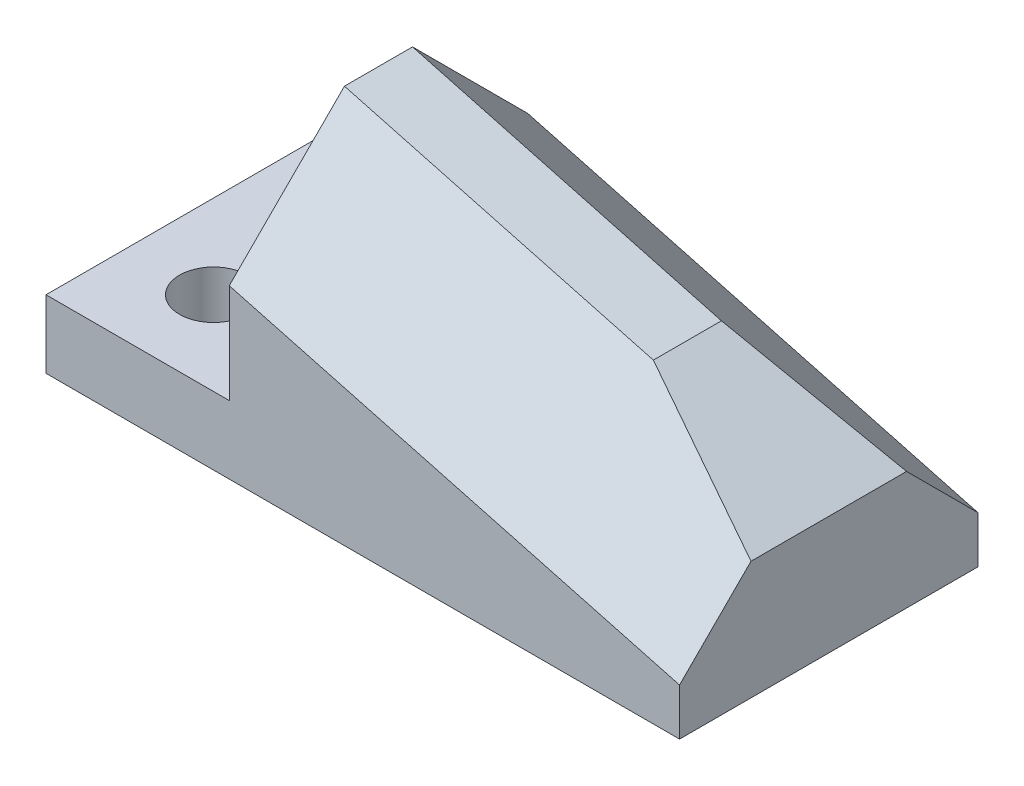
from build123d import *

# Parameters (mm, degrees)
SKETCH1_W           = 121
SKETCH1_H           = 13
BOSS_EXTRUDE1_DEPTH = 28.5
SKETCH2_R           = 6.5
CUT_EXTRUDE1_DEPTH  = 69.128554953
BOSS_EXTRUDE2_DEPTH = 57
CUT_EXTRUDE3_REACH  = 93.09
CUT_EXTRUDE4_REACH  = 93.09


with BuildPart() as part:
    # Sketch1 → Boss-Extrude1 (new, symmetric)
    with BuildSketch(Plane.XY):
        with Locations((0, 6.5)):
            Rectangle(SKETCH1_W, SKETCH1_H)
    extrude(amount=BOSS_EXTRUDE1_DEPTH, both=True)

    # Sketch2 → Cut-Extrude1 (cut, through all)
    with BuildSketch(Plane(origin=(0, 13, 0), x_dir=(1, 0, 0), z_dir=(0, 1, 0))):
        with Locations(Location((-44.5, 12.5, 0), (0, 0, 270))):
            Circle(SKETCH2_R)
        with Locations(Location((-44.5, -12.5, 0), (0, 0, 270))):
            Circle(SKETCH2_R)
    extrude(amount=-CUT_EXTRUDE1_DEPTH, mode=Mode.SUBTRACT)

    # Sketch3 → Boss-Extrude2 (add)
    with BuildSketch(Plane.XY.offset(28.5)):
        Polygon((-25.5, 13), (-25.5, 54), (33.5, 38.190997647), (60.5, 22.602540378), (60.5, 13), align=None)
    extrude(amount=-BOSS_EXTRUDE2_DEPTH)

    # Sketch7 → Cut-Extrude3 (cut, up to next)
    with BuildSketch(Plane(origin=(6.940887603, 25.903745183, 25.903745183), x_dir=(0.9825200508486979, -0.13163272708614732, -0.13163272708614732), z_dir=(0.1861567878973858, 0.6947465906068656, 0.6947465906068659)), mode=Mode.PRIVATE) as cut_extrude3_sk1:
        Polygon((-40.951405202, -0.627191909), (-40.951405202, 40.505985035), (61.941772905, 20.980207657), (61.941772905, -20.152969287), align=None)
    cut_extrude3_tool1 = extrude(cut_extrude3_sk1.sketch, amount=CUT_EXTRUDE3_REACH, mode=Mode.PRIVATE) & part.part
    add(cut_extrude3_tool1.solids().sort_by_distance((17.252616, 31.718113, 17.326358))[0], mode=Mode.SUBTRACT)

    # Sketch10 → Cut-Extrude4 (cut, up to next)
    with BuildSketch(Plane(origin=(6.940887603, 25.903745183, -25.903745183), x_dir=(-0.9825200508486979, 0.13163272708614734, -0.13163272708614734), z_dir=(0.18615678789738585, 0.6947465906068656, -0.6947465906068659)), mode=Mode.PRIVATE) as cut_extrude4_sk1:
        Polygon((44.988619568, 4.703278136), (44.988619568, 35.815976509), (-66.918136798, 14.9837742), (-66.918136798, -16.128924173), align=None)
    cut_extrude4_tool1 = extrude(cut_extrude4_sk1.sketch, amount=CUT_EXTRUDE4_REACH, mode=Mode.PRIVATE) & part.part
    add(cut_extrude4_tool1.solids().sort_by_distance((17.713983, 31.420848, -17.5))[0], mode=Mode.SUBTRACT)


solid = part.part
